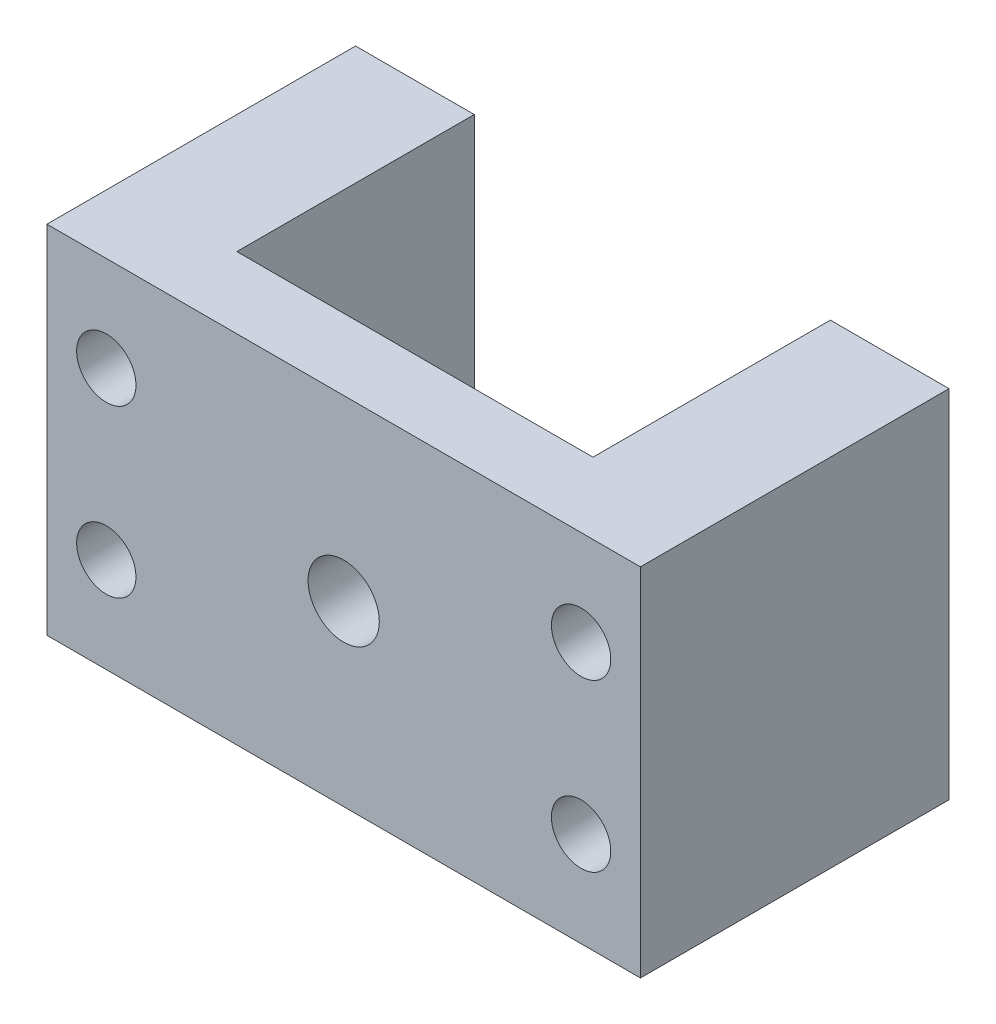
from build123d import *

# Parameters (mm, degrees)
EXTRUDE_1_DEPTH     = 15
SKETCH_2_R          = 1.25
CUT_EXTRUDE_1_DEPTH = 30.154759474
SKETCH_3_R          = 1.25
CUT_EXTRUDE_2_DEPTH = 30.154759474
SKETCH_4_R          = 1.5
CUT_EXTRUDE_3_DEPTH = 18
SKETCH_5_W          = 25
SKETCH_5_H          = 15
CUT_EXTRUDE_4_DEPTH = 1
SKETCH_6_W          = 25
SKETCH_6_H          = 15
CUT_EXTRUDE_5_DEPTH = 1


with BuildPart() as part:
    # 草图1 → 凸台-拉伸1 (new body)
    with BuildSketch(Plane(origin=(0, 0, 0), x_dir=(1, 0, 0), z_dir=(0, 1, 0))):
        Polygon((0, 0), (-5, 0), (-5, -15), (20, -15), (20, 0), (15, 0), (15, -11), (0, -11), align=None)
    extrude(amount=EXTRUDE_1_DEPTH)

    # 草图2 → 切除-拉伸1 (cut, through all)
    with BuildSketch(Plane(origin=(0, 0, 0), x_dir=(-1, 0, 0), z_dir=(0, 0, -1))):
        with Locations((-17.5, 4)):
            Circle(SKETCH_2_R)
        with Locations((-17.5, 11)):
            Circle(SKETCH_2_R)
    extrude(amount=-CUT_EXTRUDE_1_DEPTH, mode=Mode.SUBTRACT)

    # 草图3 → 切除-拉伸2 (cut, through all)
    with BuildSketch(Plane(origin=(0, 0, 0), x_dir=(-1, 0, 0), z_dir=(0, 0, -1))):
        with Locations((2.5, 4)):
            Circle(SKETCH_3_R)
        with Locations((2.5, 11)):
            Circle(SKETCH_3_R)
    extrude(amount=-CUT_EXTRUDE_2_DEPTH, mode=Mode.SUBTRACT)

    # 草图4 → 切除-拉伸3 (cut)
    with BuildSketch(Plane.XY.offset(15)):
        with Locations((7.5, 7.5)):
            Circle(SKETCH_4_R)
    extrude(amount=-CUT_EXTRUDE_3_DEPTH, mode=Mode.SUBTRACT)

    # 草图5 → 切除-拉伸4 (cut)
    with BuildSketch(Plane(origin=(0, 0, 0), x_dir=(-1, 0, 0), z_dir=(0, 0, -1))):
        with Locations((-7.5, 7.5)):
            Rectangle(SKETCH_5_W, SKETCH_5_H)
    extrude(amount=-CUT_EXTRUDE_4_DEPTH, mode=Mode.SUBTRACT)

    # 草图6 → 切除-拉伸5 (cut)
    with BuildSketch(Plane.XY.offset(15)):
        with Locations((7.5, 7.5)):
            Rectangle(SKETCH_6_W, SKETCH_6_H)
    extrude(amount=-CUT_EXTRUDE_5_DEPTH, mode=Mode.SUBTRACT)


solid = part.part
